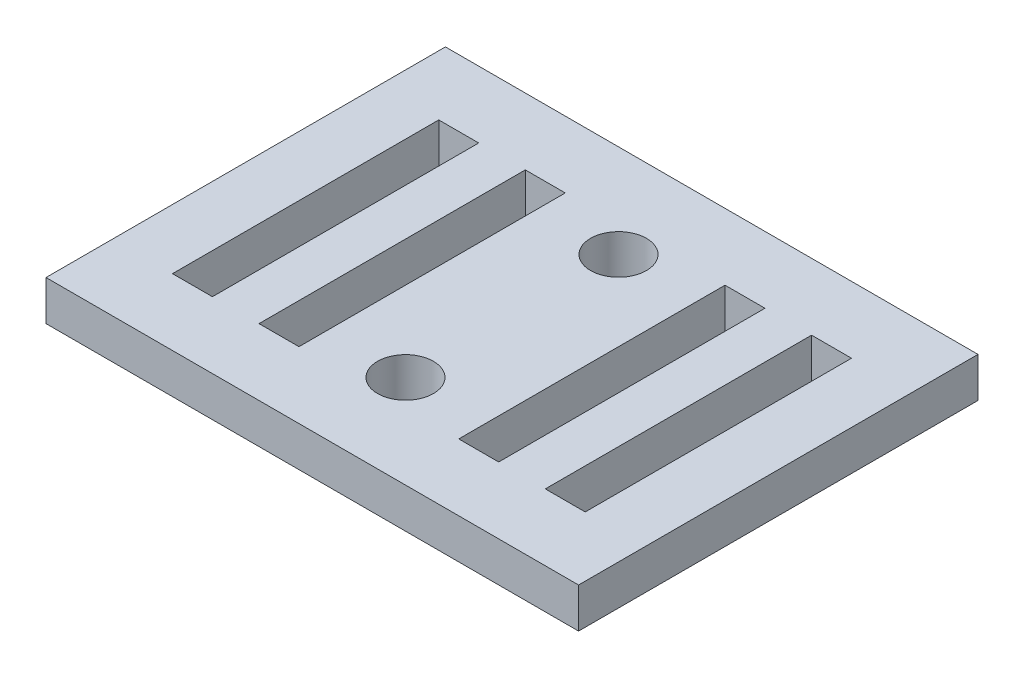
from build123d import *

# Parameters (mm, degrees)
SKETCH_1_W      = 40
SKETCH_1_H      = 30
SKETCH_1_R      = 2.1
SKETCH_1_W_2    = 3
SKETCH_1_H_2    = 20
EXTRUDE_1_DEPTH = 3


with BuildPart() as part:
    # 草图1 → 凸台-拉伸1 (new body)
    with BuildSketch(Plane(origin=(0, 0, 0), x_dir=(1, 0, 0), z_dir=(0, 1, 0))):
        with Locations((20, -15)):
            Rectangle(SKETCH_1_W, SKETCH_1_H)
        with Locations(Location((20, -23, 0), (0, 0, 270))):
            Circle(SKETCH_1_R, mode=Mode.SUBTRACT)
        with Locations(Location((20, -7, 0), (0, 0, 270))):
            Circle(SKETCH_1_R, mode=Mode.SUBTRACT)
        with Locations((6, -15)):
            Rectangle(SKETCH_1_W_2, SKETCH_1_H_2, mode=Mode.SUBTRACT)
        with Locations((34, -15)):
            Rectangle(SKETCH_1_W_2, SKETCH_1_H_2, mode=Mode.SUBTRACT)
        with Locations((27.5, -15)):
            Rectangle(SKETCH_1_W_2, SKETCH_1_H_2, mode=Mode.SUBTRACT)
        with Locations((12.5, -15)):
            Rectangle(SKETCH_1_W_2, SKETCH_1_H_2, mode=Mode.SUBTRACT)
    extrude(amount=EXTRUDE_1_DEPTH)


solid = part.part
